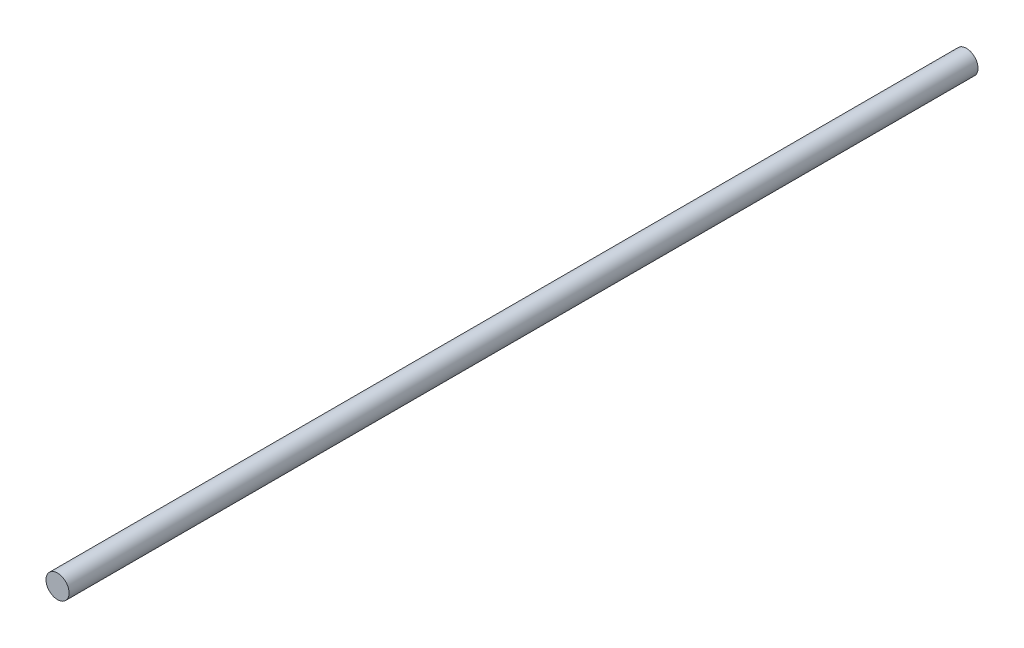
from build123d import *

# Parameters (mm, degrees)
SKETCH1_R           = 4
BOSS_EXTRUDE1_DEPTH = 157.5


with BuildPart() as part:
    # Sketch1 → Boss-Extrude1 (new, symmetric)
    with BuildSketch(Plane.XY):
        Circle(SKETCH1_R)
    extrude(amount=BOSS_EXTRUDE1_DEPTH, both=True)


solid = part.part
